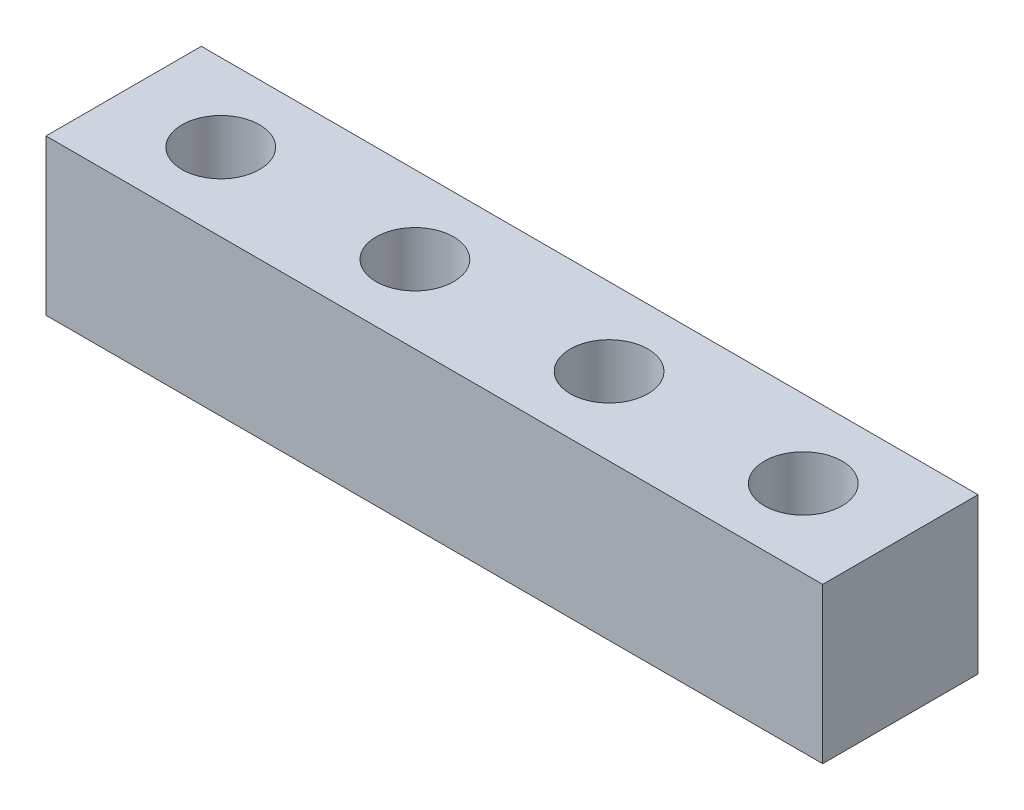
from build123d import *

# Parameters (mm, degrees)
SKETCH1_W           = 15
SKETCH1_H           = 3
SKETCH1_R           = 0.75
BOSS_EXTRUDE1_DEPTH = 3


with BuildPart() as part:
    # Sketch1 → Boss-Extrude1 (new body)
    with BuildSketch(Plane(origin=(0, 0, 0), x_dir=(1, 0, 0), z_dir=(0, 1, 0))):
        Rectangle(SKETCH1_W, SKETCH1_H)
        with Locations(Location((-5.625, 0, 0), (0, 0, 270))):
            Circle(SKETCH1_R, mode=Mode.SUBTRACT)
        with Locations(Location((-1.875, 0, 0), (0, 0, 270))):
            Circle(SKETCH1_R, mode=Mode.SUBTRACT)
        with Locations(Location((1.875, 0, 0), (0, 0, 270))):
            Circle(SKETCH1_R, mode=Mode.SUBTRACT)
        with Locations(Location((5.625, 0, 0), (0, 0, 270))):
            Circle(SKETCH1_R, mode=Mode.SUBTRACT)
    extrude(amount=BOSS_EXTRUDE1_DEPTH)


solid = part.part
